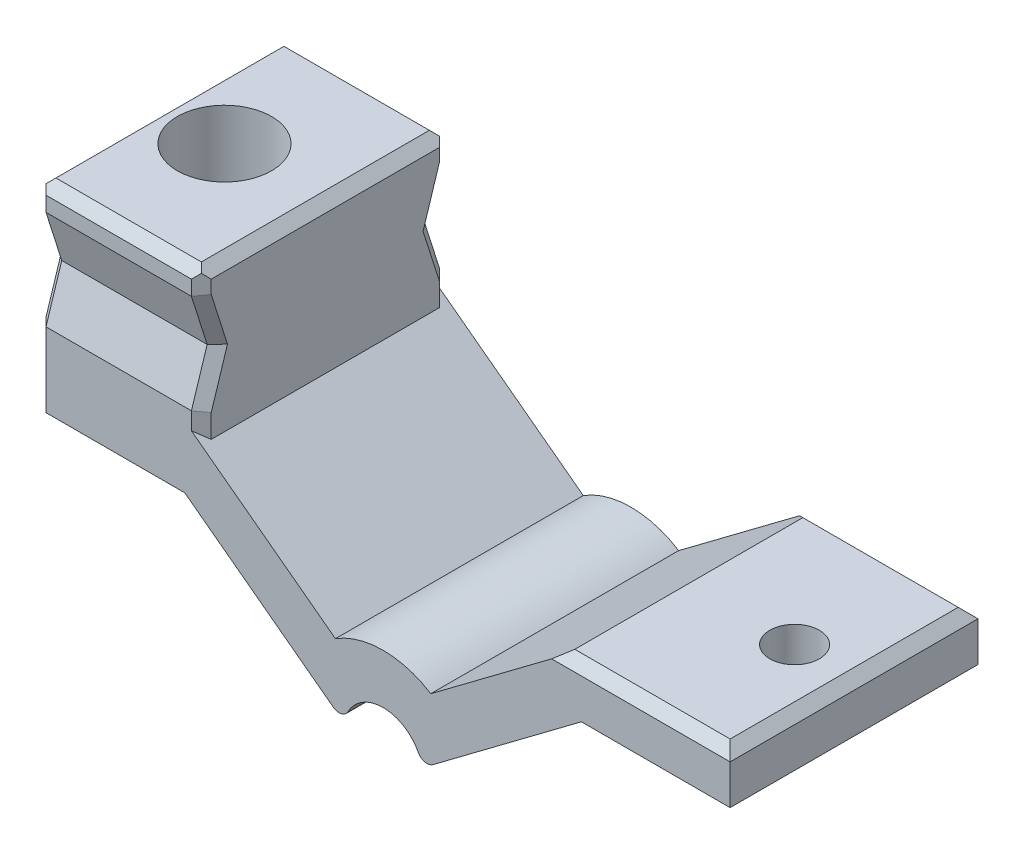
from build123d import *

# Parameters (mm, degrees)
BOSS_EXTRUDE1_DEPTH                     = 25
FILLET1_R                               = 1
CUT_EXTRUDE2_DEPTH                      = 63.343102097
CBORE_FOR_M5_HEX_HEAD_BOLT1_D           = 5.5
CBORE_FOR_M5_HEX_HEAD_BOLT1_CBORE_D     = 9.5
CBORE_FOR_M5_HEX_HEAD_BOLT1_CBORE_DEPTH = 15
F_5_0_5_DIAMETER_HOLE1_D                = 5
F_5_0_5_DIAMETER_HOLE1_DEPTH            = 15
F_5_0_5_DIAMETER_HOLE1_TIP              = 1.502151548
CHAMFER4_SIZE                           = 1
CHAMFER5_SIZE                           = 1
CHAMFER6_SIZE                           = 1
CHAMFER7_SIZE                           = 1
CHAMFER8_SIZE                           = 1
CHAMFER9_SIZE                           = 1


with BuildPart() as part:
    # Sketch1 → Boss-Extrude1 (new body)
    with BuildSketch(Plane.XY):
        with BuildLine():
            Line((23.483773769, 0.425913311), (8.483773769, 0.425913311))
            Line((8.483773769, 0.425913311), (-7.578534855, -11.620818157))
            ThreePointArc((-7.578534855, -11.620818157), (-11.516226231, -8.324086689), (-15.453917607, -11.620818157))
            Line((-15.453917607, -11.620818157), (-31.516226231, 0.425913311))
            Line((-31.516226231, 0.425913311), (-46.516226231, 0.425913311))
            Line((-46.516226231, 0.425913311), (-46.516226231, 20.425913311))
            Line((-46.516226231, 20.425913311), (-29.849559564, 20.425913311))
            Line((-29.849559564, 20.425913311), (-29.849559564, 5.425913311))
            Line((-29.849559564, 5.425913311), (-16.325743301, -4.716948887))
            ThreePointArc((-16.325743301, -4.716948887), (-11.516226231, -3.324086689), (-6.706709161, -4.716948887))
            Line((-6.706709161, -4.716948887), (6.817107102, 5.425913311))
            Line((6.817107102, 5.425913311), (23.483773769, 5.425913311))
            Line((23.483773769, 5.425913311), (23.483773769, 0.425913311))
        make_face()
    extrude(amount=BOSS_EXTRUDE1_DEPTH)

    # Fillet1
    fillet1_edges = [part.edges().sort_by_distance(p)[0] for p in [
        (-7.578534855, -11.620818157, 12.5),
        (-15.453917607, -11.620818157, 12.5),
    ]]
    fillet(fillet1_edges, radius=FILLET1_R)

    # Sketch5 → Cut-Extrude2 (cut, through all)
    with BuildSketch(Plane(origin=(-29.849559564, 0, 0), x_dir=(0, 0, -1), z_dir=(1, 0, 0))):
        Polygon((0, 7.925913311), (0, 17.925913311), (-1.586948369, 12.925913311), align=None)
        Polygon((-25, 7.925913311), (-25, 17.925913311), (-23.413051631, 12.925913311), align=None)
    extrude(amount=-CUT_EXTRUDE2_DEPTH, mode=Mode.SUBTRACT)

    # CBORE for M5 Hex Head Bolt1 (through all)
    with Locations(Plane(origin=(0, 20.425913311, 0), x_dir=(1, 0, 0), z_dir=(0, 1, 0))):
        with Locations((-40.016226231, -12.5)):
            CounterBoreHole(CBORE_FOR_M5_HEX_HEAD_BOLT1_D / 2, CBORE_FOR_M5_HEX_HEAD_BOLT1_CBORE_D / 2, CBORE_FOR_M5_HEX_HEAD_BOLT1_CBORE_DEPTH)

    # Ø5.0 (5) Diameter Hole1
    with Locations(Plane(origin=(0, 5.425913311, 0), x_dir=(1, 0, 0), z_dir=(0, 1, 0))):
        with Locations((17.483773769, -12.5)):
            Hole(F_5_0_5_DIAMETER_HOLE1_D / 2, depth=F_5_0_5_DIAMETER_HOLE1_DEPTH)
            with Locations((0, 0, -(F_5_0_5_DIAMETER_HOLE1_DEPTH + F_5_0_5_DIAMETER_HOLE1_TIP / 2))):  # 118° drill point
                Cone(0, F_5_0_5_DIAMETER_HOLE1_D / 2, F_5_0_5_DIAMETER_HOLE1_TIP, mode=Mode.SUBTRACT)

    # Chamfer4
    chamfer4_edges = [part.edges().sort_by_distance(p)[0] for p in [
        (-46.516226231, 20.425913311, 12.5),
        (-29.849559564, 20.425913311, 12.5),
    ]]
    chamfer(chamfer4_edges, length=CHAMFER4_SIZE)

    # Chamfer5
    chamfer5_edges = [part.edges().sort_by_distance(p)[0] for p in [
        (-38.182892898, 20.425913311, 25),
        (-38.182892898, 20.425913311, 0),
    ]]
    chamfer(chamfer5_edges, length=CHAMFER5_SIZE)

    # Chamfer6
    chamfer6_edges = [part.edges().sort_by_distance(p)[0] for p in [
        (-46.516226231, 4.175913311, 0),
        (-46.516226231, 15.425913311, 0.793474184),
        (-46.516226231, 10.425913311, 0.793474184),
        (-46.516226231, 18.675913311, 0),
    ]]
    chamfer(chamfer6_edges, length=CHAMFER6_SIZE)

    # Chamfer7
    chamfer7_edges = [part.edges().sort_by_distance(p)[0] for p in [
        (-46.516226231, 4.175913311, 25),
        (-46.516226231, 10.425913311, 24.206525816),
        (-46.516226231, 15.425913311, 24.206525816),
        (-46.516226231, 18.675913311, 25),
    ]]
    chamfer(chamfer7_edges, length=CHAMFER7_SIZE)

    # Chamfer8
    chamfer8_edges = [part.edges().sort_by_distance(p)[0] for p in [
        (-29.849559564, 6.675913311, 0),
        (-29.849559564, 6.675913311, 25),
        (-29.849559564, 18.675913311, 0),
        (-29.849559564, 18.675913311, 25),
        (-29.849559564, 15.425913311, 0.793474184),
        (-29.849559564, 10.425913311, 0.793474184),
        (-29.849559564, 10.425913311, 24.206525816),
        (-29.849559564, 15.425913311, 24.206525816),
    ]]
    chamfer(chamfer8_edges, length=CHAMFER8_SIZE)

    # Chamfer9
    chamfer9_edges = [part.edges().sort_by_distance(p)[0] for p in [
        (15.150440436, 5.425913311, 0),
        (23.483773769, 5.425913311, 12.5),
        (15.150440436, 5.425913311, 25),
    ]]
    chamfer(chamfer9_edges, length=CHAMFER9_SIZE)


solid = part.part
